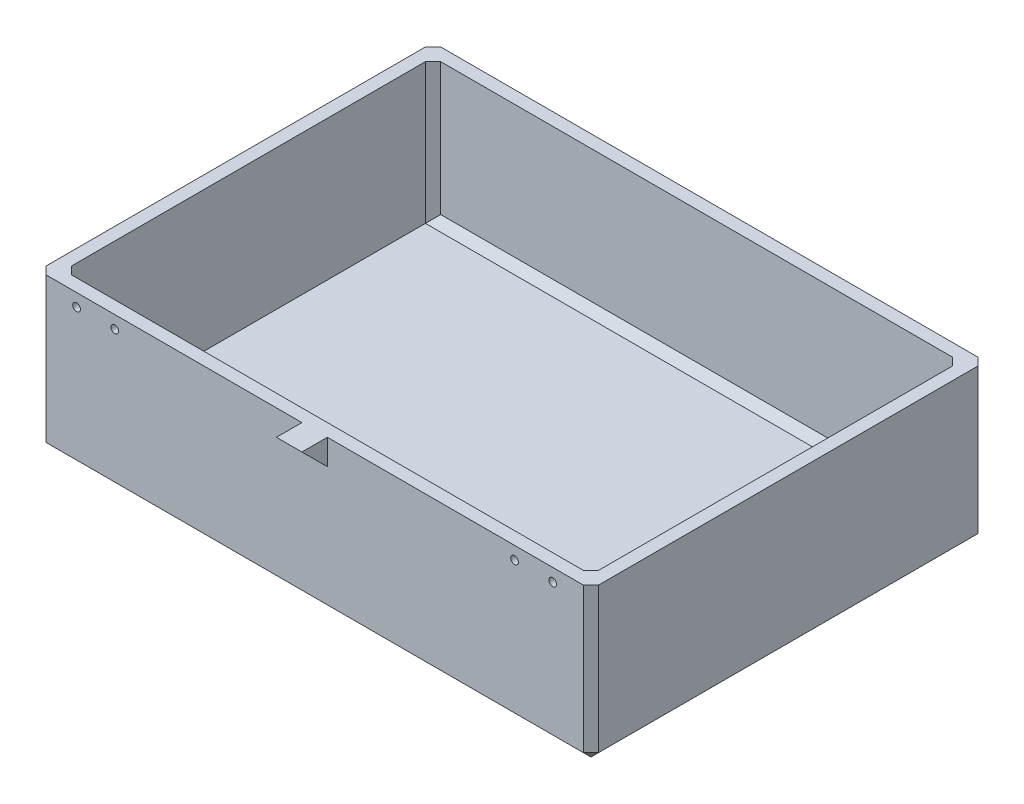
from build123d import *

# Parameters (mm, degrees)
SKIZZE2_W                       = 217
SKIZZE2_H                       = 155
AUFSATZ_LINEAR_AUSTRAGEN1_DEPTH = 60
WANDUNG1_T                      = -5
SCHNITT_LINEAR_AUSTRAGEN1_REACH = 200.487
SKIZZE7_R                       = 1.5
SKIZZE8_W                       = 10
SKIZZE8_H                       = 10
AUFSATZ_LINEAR_AUSTRAGEN2_DEPTH = 10
SCHNITT_LINEAR_AUSTRAGEN2_REACH = 157.366
FASE1_SIZE                      = 3


with BuildPart() as part:
    # Skizze2 → Aufsatz-Linear austragen1 (new body)
    with BuildSketch(Plane(origin=(0, 0, 0), x_dir=(1, 0, 0), z_dir=(0, 1, 0))):
        Rectangle(SKIZZE2_W, SKIZZE2_H)
    extrude(amount=AUFSATZ_LINEAR_AUSTRAGEN1_DEPTH)

    # Wandung1
    wandung1_openings = [part.faces().sort_by_distance(p)[0] for p in [
        (0, 60, 0),
    ]]
    offset(amount=WANDUNG1_T, openings=wandung1_openings, kind=Kind.INTERSECTION)

    # Skizze7 → Schnitt-Linear austragen1 (cut, up to next)
    with BuildSketch(Plane.XY.offset(77.5), mode=Mode.PRIVATE) as schnitt_linear_austragen1_sk1:
        with Locations((-93.5, 55)):
            Circle(SKIZZE7_R)
    schnitt_linear_austragen1_tool1 = extrude(schnitt_linear_austragen1_sk1.sketch, amount=-SCHNITT_LINEAR_AUSTRAGEN1_REACH, mode=Mode.PRIVATE) & part.part
    # Skizze7 → Schnitt-Linear austragen1 (cut, up to next)
    with BuildSketch(Plane.XY.offset(77.5), mode=Mode.PRIVATE) as schnitt_linear_austragen1_sk2:
        with Locations((-78.5, 55)):
            Circle(SKIZZE7_R)
    schnitt_linear_austragen1_tool2 = extrude(schnitt_linear_austragen1_sk2.sketch, amount=-SCHNITT_LINEAR_AUSTRAGEN1_REACH, mode=Mode.PRIVATE) & part.part
    # Skizze7 → Schnitt-Linear austragen1 (cut, up to next)
    with BuildSketch(Plane.XY.offset(77.5), mode=Mode.PRIVATE) as schnitt_linear_austragen1_sk3:
        with Locations((78.5, 55)):
            Circle(SKIZZE7_R)
    schnitt_linear_austragen1_tool3 = extrude(schnitt_linear_austragen1_sk3.sketch, amount=-SCHNITT_LINEAR_AUSTRAGEN1_REACH, mode=Mode.PRIVATE) & part.part
    # Skizze7 → Schnitt-Linear austragen1 (cut, up to next)
    with BuildSketch(Plane.XY.offset(77.5), mode=Mode.PRIVATE) as schnitt_linear_austragen1_sk4:
        with Locations((93.5, 55)):
            Circle(SKIZZE7_R)
    schnitt_linear_austragen1_tool4 = extrude(schnitt_linear_austragen1_sk4.sketch, amount=-SCHNITT_LINEAR_AUSTRAGEN1_REACH, mode=Mode.PRIVATE) & part.part
    add(schnitt_linear_austragen1_tool1.solids().sort_by_distance((-93.5, 55, 77.5))[0], mode=Mode.SUBTRACT)
    add(schnitt_linear_austragen1_tool2.solids().sort_by_distance((-78.5, 55, 77.5))[0], mode=Mode.SUBTRACT)
    add(schnitt_linear_austragen1_tool3.solids().sort_by_distance((78.5, 55, 77.5))[0], mode=Mode.SUBTRACT)
    add(schnitt_linear_austragen1_tool4.solids().sort_by_distance((93.5, 55, 77.5))[0], mode=Mode.SUBTRACT)

    # Skizze8 → Aufsatz-Linear austragen2 (add)
    with BuildSketch(Plane.XY.offset(77.5)):
        with Locations((0, 55)):
            Rectangle(SKIZZE8_W, SKIZZE8_H)
    extrude(amount=AUFSATZ_LINEAR_AUSTRAGEN2_DEPTH)

    # Skizze9 → Schnitt-Linear austragen2 (cut, up to next)
    with BuildSketch(Plane.ZY.offset(5), mode=Mode.PRIVATE) as schnitt_linear_austragen2_sk1:
        Polygon((77.5, 50), (87.5, 60), (87.5, 50), align=None)
    schnitt_linear_austragen2_tool1 = extrude(schnitt_linear_austragen2_sk1.sketch, amount=-SCHNITT_LINEAR_AUSTRAGEN2_REACH, mode=Mode.PRIVATE) & part.part
    add(schnitt_linear_austragen2_tool1.solids().sort_by_distance((-5, 53.333333, 84.166667))[0], mode=Mode.SUBTRACT)

    # Fase1
    fase1_edges = [part.edges().sort_by_distance(p)[0] for p in [
        (103.5, 5, 0),
        (103.5, 32.5, 72.5),
        (0, 5, -72.5),
        (103.5, 32.5, -72.5),
        (-103.5, 32.5, -72.5),
        (-103.5, 32.5, 72.5),
        (0, 0, 77.5),
        (-108.5, 0, 0),
        (0, 0, -77.5),
        (108.5, 0, 0),
        (108.5, 30, 77.5),
        (-108.5, 30, 77.5),
        (-108.5, 30, -77.5),
        (108.5, 30, -77.5),
    ]]
    chamfer(fase1_edges, length=FASE1_SIZE)


solid = part.part
